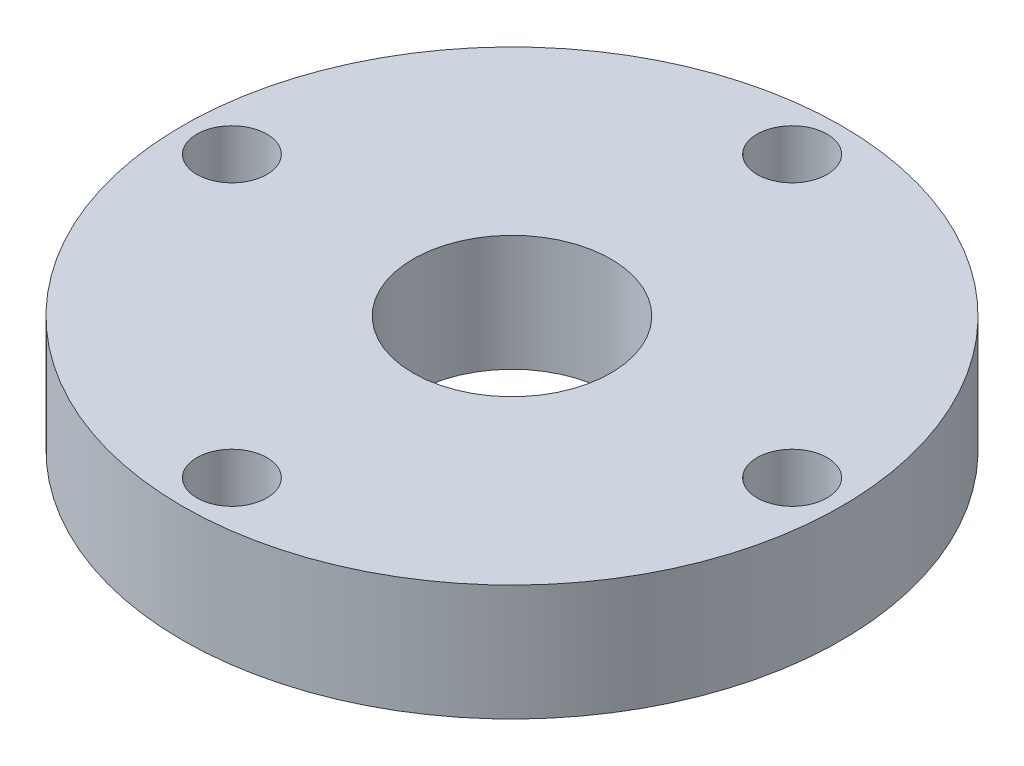
from build123d import *

# Parameters (mm, degrees)
SKETCH1_W                                         = 22.352
SKETCH1_H                                         = 63.5
CUT_EXTRUDE2_START                                = 11.176
SKETCH2_R                                         = 19.05
CUT_EXTRUDE2_DEPTH                                = 102.671320188
CBORE_FOR_5_16_SOCKET_HEAD_CAP_SCREW1_D           = 8.7376
CBORE_FOR_5_16_SOCKET_HEAD_CAP_SCREW1_DEPTH       = 22.352
CBORE_FOR_5_16_SOCKET_HEAD_CAP_SCREW1_CBORE_D     = 13.4874
CBORE_FOR_5_16_SOCKET_HEAD_CAP_SCREW1_CBORE_DEPTH = 9.652
CBORE_FOR_5_16_SOCKET_HEAD_CAP_SCREW1_TIP         = 2.625039872
CBORE_FOR_5_16_SOCKET_HEAD_CAP_SCREW2_D           = 8.7376
CBORE_FOR_5_16_SOCKET_HEAD_CAP_SCREW2_DEPTH       = 22.352
CBORE_FOR_5_16_SOCKET_HEAD_CAP_SCREW2_CBORE_D     = 13.4874
CBORE_FOR_5_16_SOCKET_HEAD_CAP_SCREW2_CBORE_DEPTH = 9.652
CBORE_FOR_5_16_SOCKET_HEAD_CAP_SCREW2_TIP         = 2.625039872


with BuildPart() as part:
    # Sketch1 → Revolve1 (revolve)
    with BuildSketch(Plane(origin=(0, 0, 0), x_dir=(0, 1, 0), z_dir=(0, 0, 1)), mode=Mode.PRIVATE) as revolve1_sk:
        with Locations((0, 31.75)):
            Rectangle(SKETCH1_W, SKETCH1_H)
    revolve(revolve1_sk.sketch.rotate(Axis((0, -36.576, 0), (0, 1, 0)), 270), axis=Axis((0, -36.576, 0), (0, 1, 0)))

    # Sketch2 → Cut-Extrude2 (cut, through all)
    with BuildSketch(Plane(origin=(0, 0, 0), x_dir=(-1, 0, 0), z_dir=(0, 1, 0)).offset(CUT_EXTRUDE2_START)):
        with Locations(Location((0, 0, 0), (0, 0, 90))):
            Circle(SKETCH2_R)
    extrude(amount=-CUT_EXTRUDE2_DEPTH, mode=Mode.SUBTRACT)

    # CBORE for 5/16 Socket Head Cap Screw1
    with Locations(Plane(origin=(0, 11.176, 0), x_dir=(1, 0, 0), z_dir=(0, 1, 0))):
        with Locations((-53.975, 0)):
            CounterBoreHole(CBORE_FOR_5_16_SOCKET_HEAD_CAP_SCREW1_D / 2, CBORE_FOR_5_16_SOCKET_HEAD_CAP_SCREW1_CBORE_D / 2, CBORE_FOR_5_16_SOCKET_HEAD_CAP_SCREW1_CBORE_DEPTH, depth=CBORE_FOR_5_16_SOCKET_HEAD_CAP_SCREW1_DEPTH)
            with Locations((0, 0, -(CBORE_FOR_5_16_SOCKET_HEAD_CAP_SCREW1_DEPTH + CBORE_FOR_5_16_SOCKET_HEAD_CAP_SCREW1_TIP / 2))):  # 118° drill point
                Cone(0, CBORE_FOR_5_16_SOCKET_HEAD_CAP_SCREW1_D / 2, CBORE_FOR_5_16_SOCKET_HEAD_CAP_SCREW1_TIP, mode=Mode.SUBTRACT)

    # CBORE for 5/16 Socket Head Cap Screw2
    with Locations(Plane(origin=(0, 11.176, 0), x_dir=(1, 0, 0), z_dir=(0, 1, 0))):
        with Locations((0, -53.975), (53.975, 0), (0, 53.975)):
            CounterBoreHole(CBORE_FOR_5_16_SOCKET_HEAD_CAP_SCREW2_D / 2, CBORE_FOR_5_16_SOCKET_HEAD_CAP_SCREW2_CBORE_D / 2, CBORE_FOR_5_16_SOCKET_HEAD_CAP_SCREW2_CBORE_DEPTH, depth=CBORE_FOR_5_16_SOCKET_HEAD_CAP_SCREW2_DEPTH)
            with Locations((0, 0, -(CBORE_FOR_5_16_SOCKET_HEAD_CAP_SCREW2_DEPTH + CBORE_FOR_5_16_SOCKET_HEAD_CAP_SCREW2_TIP / 2))):  # 118° drill point
                Cone(0, CBORE_FOR_5_16_SOCKET_HEAD_CAP_SCREW2_D / 2, CBORE_FOR_5_16_SOCKET_HEAD_CAP_SCREW2_TIP, mode=Mode.SUBTRACT)


solid = part.part
